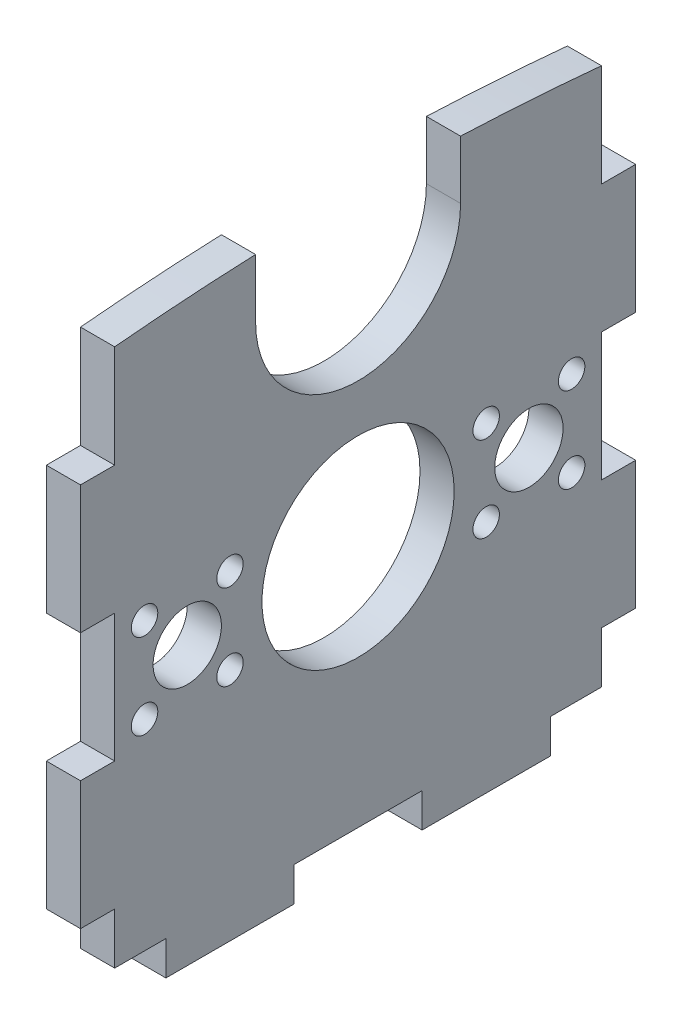
from build123d import *

# Parameters (mm, degrees)
SKETCH1_W           = 65
SKETCH1_H           = 65
BOSS_EXTRUDE1_DEPTH = 4
SKETCH2_R           = 11.25
CUT_EXTRUDE1_DEPTH  = 4
SKETCH3_W           = 10
SKETCH3_H           = 4
SKETCH3_W_2         = 15
CUT_EXTRUDE2_DEPTH  = 4
SKETCH5_W           = 4
SKETCH5_H           = 6
SKETCH5_H_2         = 15
CUT_EXTRUDE3_DEPTH  = 4
SKETCH6_R           = 1.55
SKETCH6_R_2         = 4
CUT_EXTRUDE4_DEPTH  = 4
BOSS_EXTRUDE3_DEPTH = 4
CUT_EXTRUDE6_DEPTH  = 4


with BuildPart() as part:
    # Sketch1 → Boss-Extrude1 (new body)
    with BuildSketch(Plane(origin=(0, 0, 0), x_dir=(0, 0, -1), z_dir=(1, 0, 0))):
        with Locations((32.5, 32.5)):
            Rectangle(SKETCH1_W, SKETCH1_H)
    extrude(amount=BOSS_EXTRUDE1_DEPTH)

    # Sketch2 → Cut-Extrude1 (cut)
    with BuildSketch(Plane(origin=(4, 0, 0), x_dir=(0, 0, -1), z_dir=(1, 0, 0))):
        with Locations((32.5, 32.5)):
            Circle(SKETCH2_R)
    extrude(amount=-CUT_EXTRUDE1_DEPTH, mode=Mode.SUBTRACT)

    # Sketch3 → Cut-Extrude2 (cut)
    with BuildSketch(Plane(origin=(4, 0, 0), x_dir=(0, 0, -1), z_dir=(1, 0, 0))):
        with Locations((5, 63)):
            Rectangle(SKETCH3_W, SKETCH3_H)
        with Locations((32.5, 63)):
            Rectangle(SKETCH3_W_2, SKETCH3_H)
        with Locations((60, 63)):
            Rectangle(SKETCH3_W, SKETCH3_H)
        with Locations((60, 2)):
            Rectangle(SKETCH3_W, SKETCH3_H)
        with Locations((32.5, 2)):
            Rectangle(SKETCH3_W_2, SKETCH3_H)
        with Locations((5, 2)):
            Rectangle(SKETCH3_W, SKETCH3_H)
    extrude(amount=-CUT_EXTRUDE2_DEPTH, mode=Mode.SUBTRACT)

    # Sketch5 → Cut-Extrude3 (cut)
    with BuildSketch(Plane(origin=(4, 0, 0), x_dir=(0, 0, -1), z_dir=(1, 0, 0))):
        with Locations((2, 58)):
            Rectangle(SKETCH5_W, SKETCH5_H)
        with Locations((2, 32.5)):
            Rectangle(SKETCH5_W, SKETCH5_H_2)
        with Locations((2, 7)):
            Rectangle(SKETCH5_W, SKETCH5_H)
        with Locations((63, 7)):
            Rectangle(SKETCH5_W, SKETCH5_H)
        with Locations((63, 32.5)):
            Rectangle(SKETCH5_W, SKETCH5_H_2)
        with Locations((63, 58)):
            Rectangle(SKETCH5_W, SKETCH5_H)
    extrude(amount=-CUT_EXTRUDE3_DEPTH, mode=Mode.SUBTRACT)

    # Sketch6 → Cut-Extrude4 (cut)
    with BuildSketch(Plane(origin=(4, 0, 0), x_dir=(0, 0, -1), z_dir=(1, 0, 0))):
        with Locations((7.5, 37.5)):
            Circle(SKETCH6_R)
        with Locations((17.5, 37.5)):
            Circle(SKETCH6_R)
        with Locations((17.5, 27.5)):
            Circle(SKETCH6_R)
        with Locations((12.5, 32.5)):
            Circle(SKETCH6_R_2)
        with Locations((7.5, 27.5)):
            Circle(SKETCH6_R)
        with Locations((52.5, 32.5)):
            Circle(SKETCH6_R_2)
        with Locations((47.5, 27.5)):
            Circle(SKETCH6_R)
        with Locations((47.5, 37.5)):
            Circle(SKETCH6_R)
        with Locations((57.5, 37.5)):
            Circle(SKETCH6_R)
        with Locations((57.5, 27.5)):
            Circle(SKETCH6_R)
    extrude(amount=-CUT_EXTRUDE4_DEPTH, mode=Mode.SUBTRACT)

    # Sketch12 → Boss-Extrude3 (add)
    with BuildSketch(Plane(origin=(4, 0, 0), x_dir=(0, 0, -1), z_dir=(1, 0, 0))):
        with BuildLine():
            Line((4, 67), (4, 61))
            Line((4, 61), (10, 61))
            Line((10, 61), (10, 65))
            Line((10, 65), (25, 65))
            Line((25, 65), (25, 61))
            Line((25, 61), (40, 61))
            Line((40, 61), (40, 65))
            Line((40, 65), (55, 65))
            Line((55, 65), (55, 61))
            Line((55, 61), (61, 61))
            Line((61, 61), (61, 67))
            ThreePointArc((61, 67), (32.5, 68.351492738), (4, 67))
        make_face()
    extrude(amount=-BOSS_EXTRUDE3_DEPTH)

    # Sketch11 → Cut-Extrude6 (cut)
    with BuildSketch(Plane(origin=(4, 0, 0), x_dir=(0, 0, -1), z_dir=(1, 0, 0))):
        with BuildLine():
            ThreePointArc((20.5, 61.291011979), (32.5, 49.291011979), (44.5, 61.291011979))
            Line((44.5, 61.291011979), (44.5, 74.592318289))
            Line((44.5, 74.592318289), (20.5, 74.592318289))
            Line((20.5, 74.592318289), (20.5, 61.291011979))
        make_face()
    extrude(amount=-CUT_EXTRUDE6_DEPTH, mode=Mode.SUBTRACT)


solid = part.part
